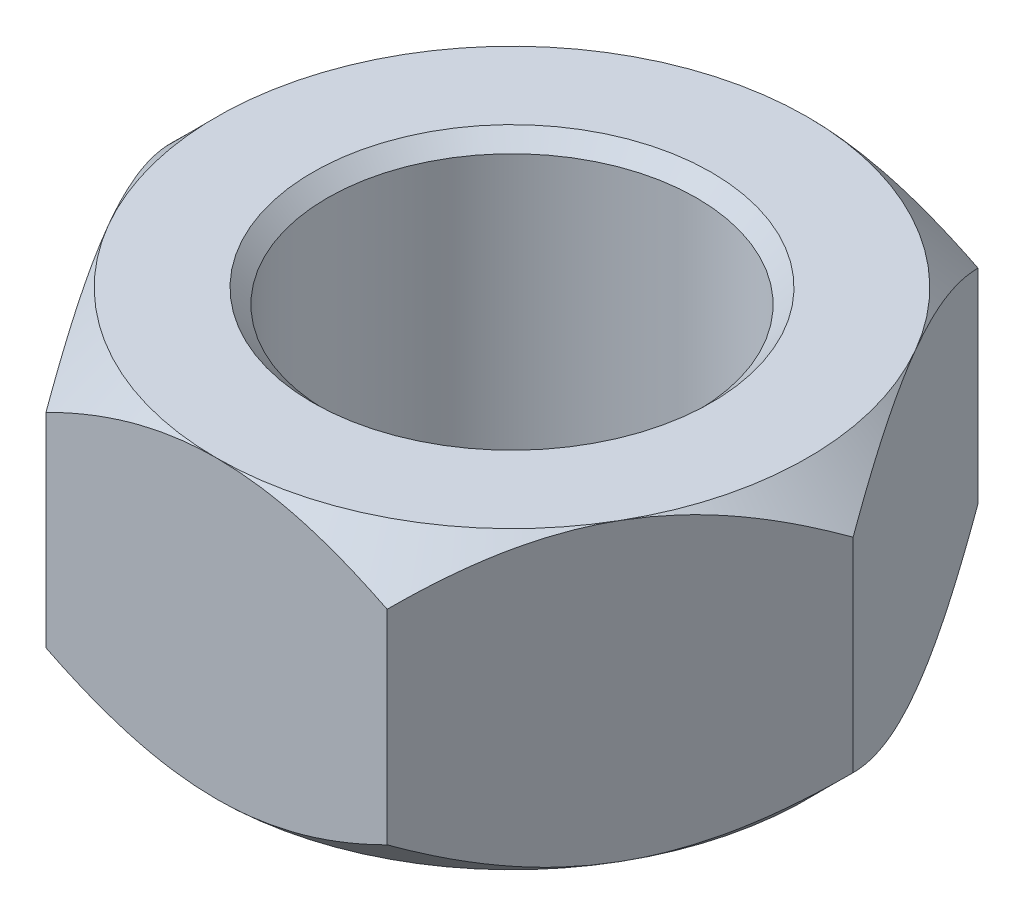
from build123d import *

# Parameters (mm, degrees)
SKETCH1_R           = 2.5
BOSS_EXTRUDE1_DEPTH = 4
CHAMFER1_SIZE       = 0.2


with BuildPart() as part:
    # Sketch1 → Boss-Extrude1 (new body)
    with BuildSketch(Plane(origin=(0, 0, 0), x_dir=(1, 0, 0), z_dir=(0, 1, 0))):
        Polygon((-2.309401077, 4), (-4.618802154, 0), (-2.309401077, -4), (2.309401077, -4), (4.618802154, 0), (2.309401077, 4), align=None)
        with Locations(Location((0, 0, 0), (0, 0, 270))):
            Circle(SKETCH1_R, mode=Mode.SUBTRACT)
    extrude(amount=BOSS_EXTRUDE1_DEPTH)

    # Chamfer1
    chamfer1_edges = [part.edges().sort_by_distance(p)[0] for p in [
        (0, 0, -2.5),
        (0, 4, -2.5),
    ]]
    chamfer(chamfer1_edges, length=CHAMFER1_SIZE)

    # Sketch2 → Cut-Revolve1 (revolve, cut)
    with BuildSketch(Plane.XY):
        Polygon((-4, 4), (-5, 3), (-5, 4), align=None)
        Polygon((-5, 0), (-4, 0), (-5, 1), align=None)
    revolve(axis=Axis((0, 0, 0), (0, 1, 0)), mode=Mode.SUBTRACT)


solid = part.part
